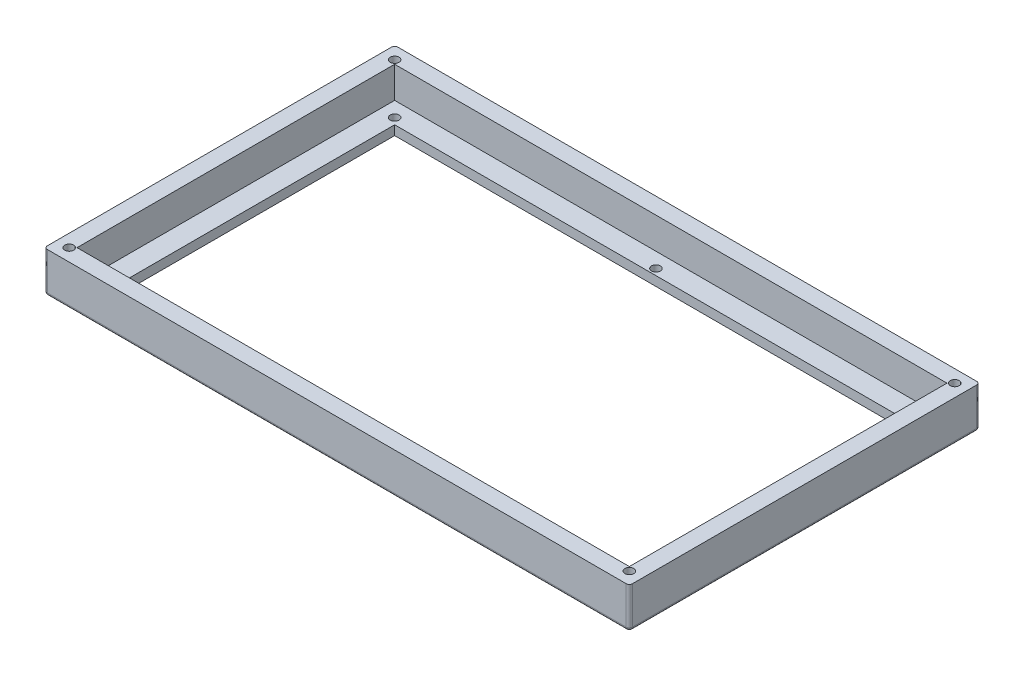
from build123d import *

# Parameters (mm, degrees)
SKETCH1_W    = 187
SKETCH1_H    = 112
SKETCH1_R    = 1.425
SKETCH1_W_2  = 163
SKETCH1_H_2  = 88
BASE_DEPTH   = 3
SKETCH3_W    = 187
SKETCH3_H    = 112
SKETCH3_R    = 1.425
SKETCH3_W_2  = 176.5
SKETCH3_H_2  = 101.5
EDGE_2_DEPTH = 10
FILLET1_R    = 1


with BuildPart() as part:
    # Sketch1 → Base (new body)
    with BuildSketch(Plane(origin=(0, 0, 0), x_dir=(1, 0, 0), z_dir=(0, 1, 0))):
        Rectangle(SKETCH1_W, SKETCH1_H)
        with Locations((-89.5, -52)):
            Circle(SKETCH1_R, mode=Mode.SUBTRACT)
        with Locations((89.5, -52)):
            Circle(SKETCH1_R, mode=Mode.SUBTRACT)
        with Locations((89.5, 52)):
            Circle(SKETCH1_R, mode=Mode.SUBTRACT)
        with Locations((-89.5, 52)):
            Circle(SKETCH1_R, mode=Mode.SUBTRACT)
        with Locations((-83.5, -46)):
            Circle(SKETCH1_R, mode=Mode.SUBTRACT)
        with Locations((0, -46)):
            Circle(SKETCH1_R, mode=Mode.SUBTRACT)
        with Locations((83.5, -46)):
            Circle(SKETCH1_R, mode=Mode.SUBTRACT)
        with Locations((0, 46)):
            Circle(SKETCH1_R, mode=Mode.SUBTRACT)
        with Locations((83.5, 46)):
            Circle(SKETCH1_R, mode=Mode.SUBTRACT)
        with Locations((-83.5, 46)):
            Circle(SKETCH1_R, mode=Mode.SUBTRACT)
        Rectangle(SKETCH1_W_2, SKETCH1_H_2, mode=Mode.SUBTRACT)
    extrude(amount=BASE_DEPTH)

    # Sketch3 → Edge 2 (add)
    with BuildSketch(Plane(origin=(0, 3, 0), x_dir=(1, 0, 0), z_dir=(0, 1, 0))):
        Rectangle(SKETCH3_W, SKETCH3_H)
        with Locations((-89.5, -52)):
            Circle(SKETCH3_R, mode=Mode.SUBTRACT)
        with Locations((89.5, -52)):
            Circle(SKETCH3_R, mode=Mode.SUBTRACT)
        with Locations((89.5, 52)):
            Circle(SKETCH3_R, mode=Mode.SUBTRACT)
        with Locations((-89.5, 52)):
            Circle(SKETCH3_R, mode=Mode.SUBTRACT)
        Rectangle(SKETCH3_W_2, SKETCH3_H_2, mode=Mode.SUBTRACT)
    extrude(amount=EDGE_2_DEPTH)

    # Fillet1
    fillet1_edges = [part.edges().sort_by_distance(p)[0] for p in [
        (0, 0, 56),
        (93.5, 6.5, 56),
        (93.5, 0, 0),
        (93.5, 6.5, -56),
        (0, 0, -56),
        (-93.5, 0, 0),
        (-93.5, 6.5, -56),
        (-93.5, 6.5, 56),
    ]]
    fillet(fillet1_edges, radius=FILLET1_R)


solid = part.part
